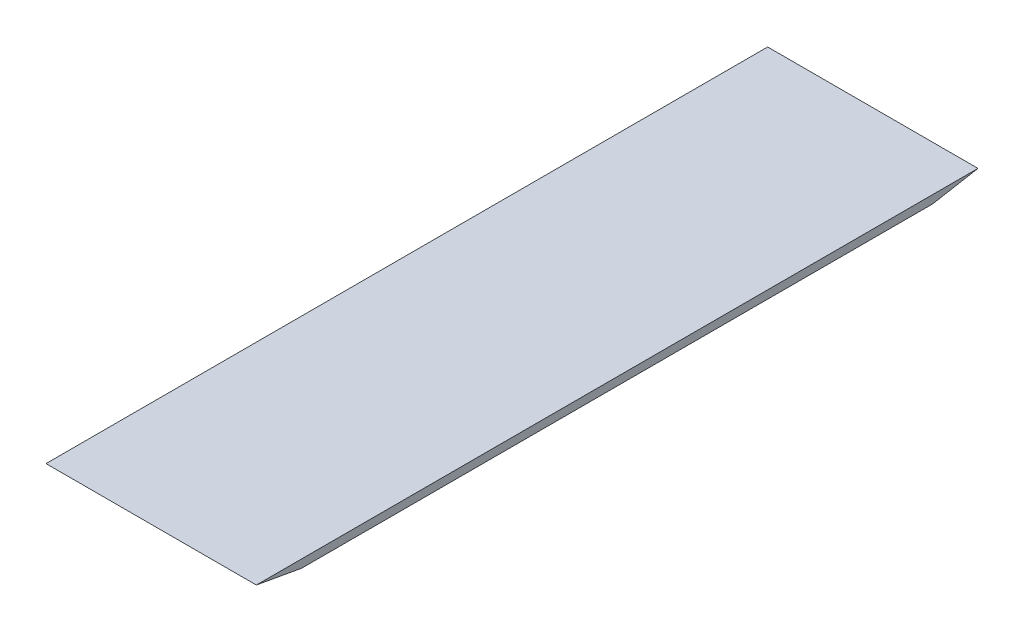
from build123d import *

# Parameters (mm, degrees)
BOSS_EXTRUDE1_DEPTH = 130


with BuildPart() as part:
    # Sketch1 → Boss-Extrude1 (new body)
    with BuildSketch(Plane(origin=(0, 0, 0), x_dir=(0, 0, -1), z_dir=(1, 0, 0))):
        Polygon((0, 0), (446, 0), (418, -5), (28, -5), align=None)
    extrude(amount=BOSS_EXTRUDE1_DEPTH)


solid = part.part
